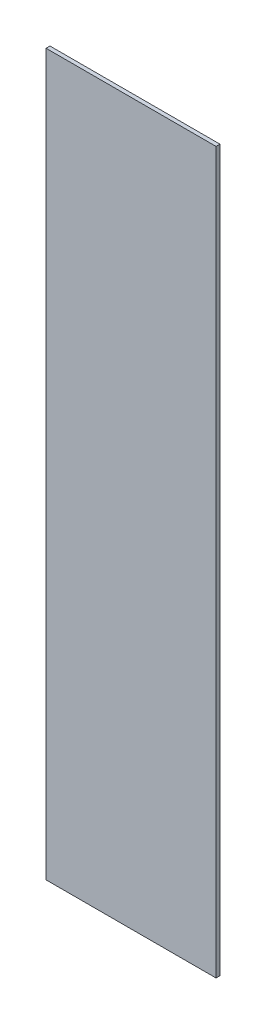
from build123d import *

# Parameters (mm, degrees)
ESQUISSE1_W        = 433.5
ESQUISSE1_H        = 1837
BOSS_EXTRU_1_DEPTH = 10


with BuildPart() as part:
    # Esquisse1 → Boss.-Extru.1 (new body)
    with BuildSketch(Plane.XY):
        Rectangle(ESQUISSE1_W, ESQUISSE1_H)
    extrude(amount=BOSS_EXTRU_1_DEPTH)


solid = part.part
